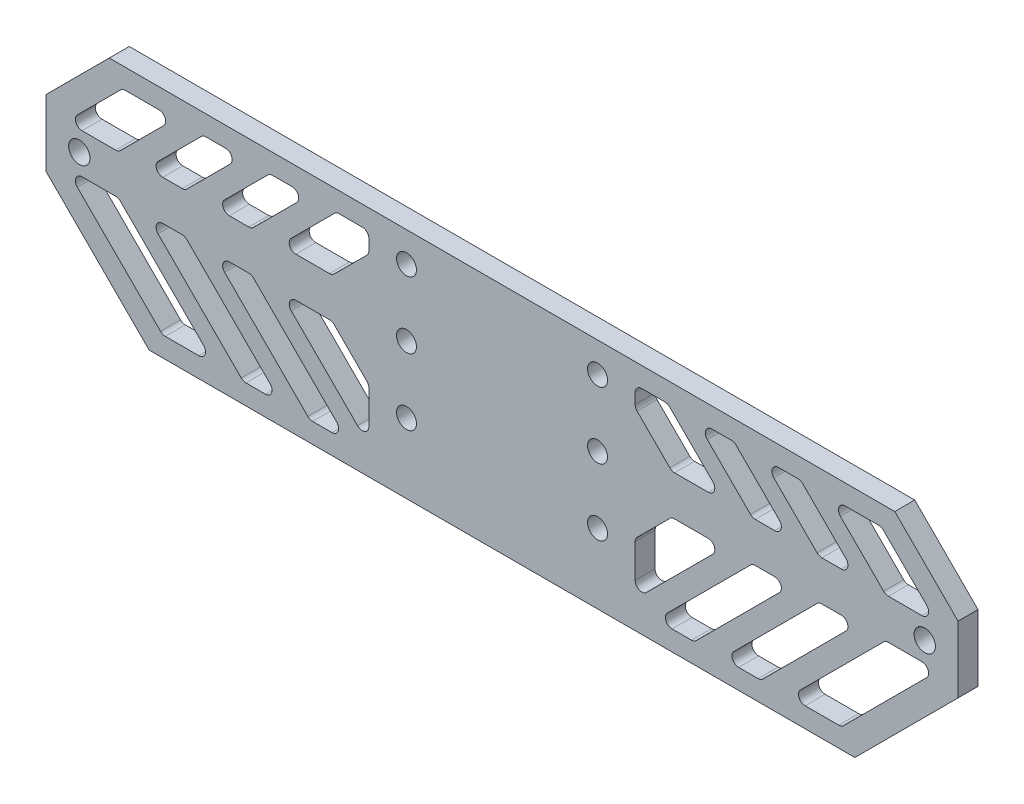
from build123d import *

# Parameters (mm, degrees)
SKETCH_1_W             = 32.7
SKETCH_1_H             = 29
SKETCH_1_R             = 1.5
EXTRUDE_1_DEPTH        = 3
CHAMFER_1_SIZE         = 3
EXTRUDE_2_DEPTH        = 3
CHAMFER_2_SIZE         = 9.5
EXTRUDE_3_DEPTH        = 3
SKETCH_6_R             = 1.6
CUT_EXTRUDE_2_DEPTH    = 72.564656081
CUT_EXTRUDE_4_DEPTH    = 10
FILLET_2_R             = 1
FILLET_2_OF_MIRROR_1_R = 1


with BuildPart() as part:
    # 草图1 → 凸台-拉伸1 (new body)
    with BuildSketch(Plane.XY):
        Rectangle(SKETCH_1_W, SKETCH_1_H)
        with Locations((-14.35, -10)):
            Circle(SKETCH_1_R, mode=Mode.SUBTRACT)
        with Locations((-14.35, 10)):
            Circle(SKETCH_1_R, mode=Mode.SUBTRACT)
        with Locations((14.35, 10)):
            Circle(SKETCH_1_R, mode=Mode.SUBTRACT)
        with Locations((14.35, -10)):
            Circle(SKETCH_1_R, mode=Mode.SUBTRACT)
        with Locations((-14.35, 0)):
            Circle(SKETCH_1_R, mode=Mode.SUBTRACT)
        with Locations((14.35, 0)):
            Circle(SKETCH_1_R, mode=Mode.SUBTRACT)
    extrude(amount=EXTRUDE_1_DEPTH)

    # 倒角1
    chamfer_1_edges = [part.edges().sort_by_distance(p)[0] for p in [
        (16.35, -14.5, 1.5),
        (-16.35, -14.5, 1.5),
        (-16.35, 14.5, 1.5),
        (16.35, 14.5, 1.5),
    ]]
    chamfer(chamfer_1_edges, length=CHAMFER_1_SIZE)

    # 草图3 → 凸台-拉伸2 (add)
    with BuildSketch(Plane.XY.offset(3)):
        Polygon((-13.35, 14.5), (-68.5, 14.5), (-68.5, -14.5), (-13.35, -14.5), (-16.35, -11.5), (-16.35, 11.5), align=None)
        Polygon((68.5, 14.5), (13.35, 14.5), (16.35, 11.5), (16.35, -11.5), (13.35, -14.5), (68.5, -14.5), align=None)
    extrude(amount=-EXTRUDE_2_DEPTH)

    # 倒角2
    chamfer_2_edges = [part.edges().sort_by_distance(p)[0] for p in [
        (-68.5, -14.5, 1.5),
        (-68.5, 14.5, 1.5),
        (68.5, -14.5, 1.5),
        (68.5, 14.5, 1.5),
    ]]
    chamfer(chamfer_2_edges, length=CHAMFER_2_SIZE)

    # 草图4 → 凸台-拉伸3 (add)
    with BuildSketch(Plane(origin=(0, 0, 0), x_dir=(-1, 0, 0), z_dir=(0, 0, -1))):
        Polygon((-59, -14.5), (-53, -20.5), (53, -20.5), (59, -14.5), align=None)
    extrude(amount=-EXTRUDE_3_DEPTH)

    # 草图6 → 切除-拉伸2 (cut, through all)
    with BuildSketch(Plane(origin=(0, 0, 0), x_dir=(-1, 0, 0), z_dir=(0, 0, -1))):
        with Locations((-63.5, 0)):
            Circle(SKETCH_6_R)
    cut_extrude_2 = extrude(amount=-CUT_EXTRUDE_2_DEPTH, mode=Mode.SUBTRACT)

    # 草图7 → 切除-拉伸4 (cut)
    with BuildSketch(Plane(origin=(0, 0, 0), x_dir=(-1, 0, 0), z_dir=(0, 0, -1))):
        Polygon((-57, 11.5), (-65.5, 3), (-57.621320344, 3), (-49.121320344, 11.5), align=None)
        Polygon((-57.621320344, -3), (-65.5, -3), (-51, -17.5), (-43.121320344, -17.5), align=None)
        Polygon((-47.621320344, -3), (-53.378679656, -3), (-38.878679656, -17.5), (-33.121320344, -17.5), align=None)
        Polygon((-44.878679656, 11.5), (-53.378679656, 3), (-47.621320344, 3), (-39.121320344, 11.5), align=None)
        Polygon((-34.878679656, 11.5), (-43.378679656, 3), (-37.621320344, 3), (-29.121320344, 11.5), align=None)
        Polygon((-23.121320344, -17.5), (-37.621320344, -3), (-43.378679656, -3), (-28.878679656, -17.5), align=None)
        Polygon((-20, -8.5), (-25.5, -3), (-33.378679656, -3), (-20, -16.378679656), align=None)
        Polygon((-33.378679656, 3), (-25.5, 3), (-20, 8.5), (-20, 11.5), (-23, 11.5), (-24.878679656, 11.5), align=None)
    cut_extrude_4 = extrude(amount=-CUT_EXTRUDE_4_DEPTH, mode=Mode.SUBTRACT)

    # 圆角2
    fillet_2_edges = [part.edges().sort_by_distance(p)[0] for p in [
        (53.378679656, -3, 1.5),
        (47.621320344, -3, 1.5),
        (33.121320344, -17.5, 1.5),
        (38.878679656, -17.5, 1.5),
        (57.621320344, -3, 1.5),
        (43.121320344, -17.5, 1.5),
        (51, -17.5, 1.5),
        (65.5, -3, 1.5),
        (37.621320344, 3, 1.5),
        (43.378679656, 3, 1.5),
        (34.878679656, 11.5, 1.5),
        (29.121320344, 11.5, 1.5),
        (47.621320344, 3, 1.5),
        (53.378679656, 3, 1.5),
        (44.878679656, 11.5, 1.5),
        (39.121320344, 11.5, 1.5),
        (33.378679656, -3, 1.5),
        (25.5, -3, 1.5),
        (20, -8.5, 1.5),
        (20, -16.378679656, 1.5),
        (43.378679656, -3, 1.5),
        (37.621320344, -3, 1.5),
        (23.121320344, -17.5, 1.5),
        (28.878679656, -17.5, 1.5),
        (33.378679656, 3, 1.5),
        (24.878679656, 11.5, 1.5),
        (20, 11.5, 1.5),
        (20, 8.5, 1.5),
        (25.5, 3, 1.5),
        (57.621320344, 3, 1.5),
        (65.5, 3, 1.5),
        (57, 11.5, 1.5),
        (49.121320344, 11.5, 1.5),
    ]]
    fillet(fillet_2_edges, radius=FILLET_2_R)

    # 镜向1: 切除-拉伸2, 切除-拉伸4 across plane
    add(cut_extrude_2.mirror(Plane(origin=(0, 0, 0), x_dir=(0, 0, 1), z_dir=(1, 0, 0))), mode=Mode.SUBTRACT)
    add(cut_extrude_4.mirror(Plane(origin=(0, 0, 0), x_dir=(0, 0, 1), z_dir=(1, 0, 0))), mode=Mode.SUBTRACT)

    # 圆角2 of 镜向1
    fillet_2_of_mirror_1_edges = [part.edges().sort_by_distance(p)[0] for p in [
        (-53.378679656, -3, 1.5),
        (-47.621320344, -3, 1.5),
        (-33.121320344, -17.5, 1.5),
        (-38.878679656, -17.5, 1.5),
        (-57.621320344, -3, 1.5),
        (-43.121320344, -17.5, 1.5),
        (-51, -17.5, 1.5),
        (-65.5, -3, 1.5),
        (-37.621320344, 3, 1.5),
        (-43.378679656, 3, 1.5),
        (-34.878679656, 11.5, 1.5),
        (-29.121320344, 11.5, 1.5),
        (-47.621320344, 3, 1.5),
        (-53.378679656, 3, 1.5),
        (-44.878679656, 11.5, 1.5),
        (-39.121320344, 11.5, 1.5),
        (-33.378679656, -3, 1.5),
        (-25.5, -3, 1.5),
        (-20, -8.5, 1.5),
        (-20, -16.378679656, 1.5),
        (-43.378679656, -3, 1.5),
        (-37.621320344, -3, 1.5),
        (-23.121320344, -17.5, 1.5),
        (-28.878679656, -17.5, 1.5),
        (-33.378679656, 3, 1.5),
        (-24.878679656, 11.5, 1.5),
        (-20, 11.5, 1.5),
        (-20, 8.5, 1.5),
        (-25.5, 3, 1.5),
        (-57.621320344, 3, 1.5),
        (-65.5, 3, 1.5),
        (-57, 11.5, 1.5),
        (-49.121320344, 11.5, 1.5),
    ]]
    fillet(fillet_2_of_mirror_1_edges, radius=FILLET_2_OF_MIRROR_1_R)


solid = part.part
